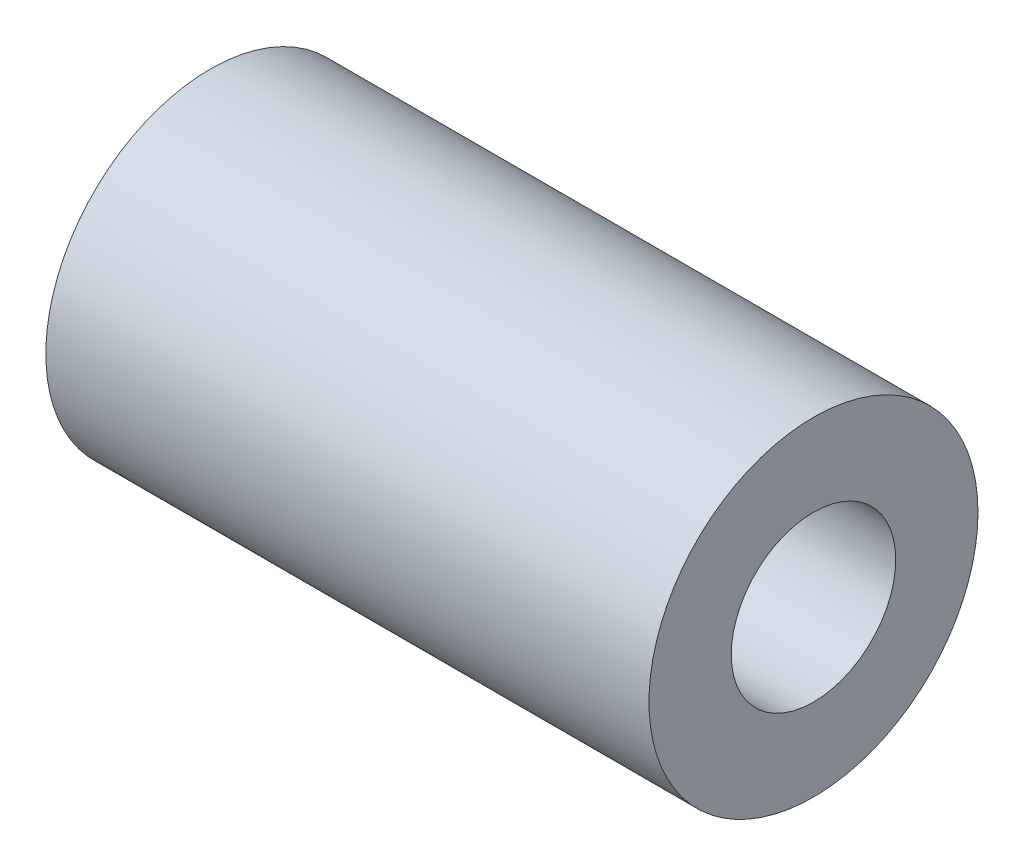
from build123d import *

# Parameters (mm, degrees)
SKETCH_1_R      = 3
SKETCH_1_R_2    = 1.5
EXTRUDE_1_DEPTH = 11


with BuildPart() as part:
    # 草图1 → 凸台-拉伸1 (new body)
    with BuildSketch(Plane(origin=(0, 0, 0), x_dir=(0, 0, -1), z_dir=(1, 0, 0))):
        Circle(SKETCH_1_R)
        Circle(SKETCH_1_R_2, mode=Mode.SUBTRACT)
    extrude(amount=EXTRUDE_1_DEPTH)


solid = part.part
